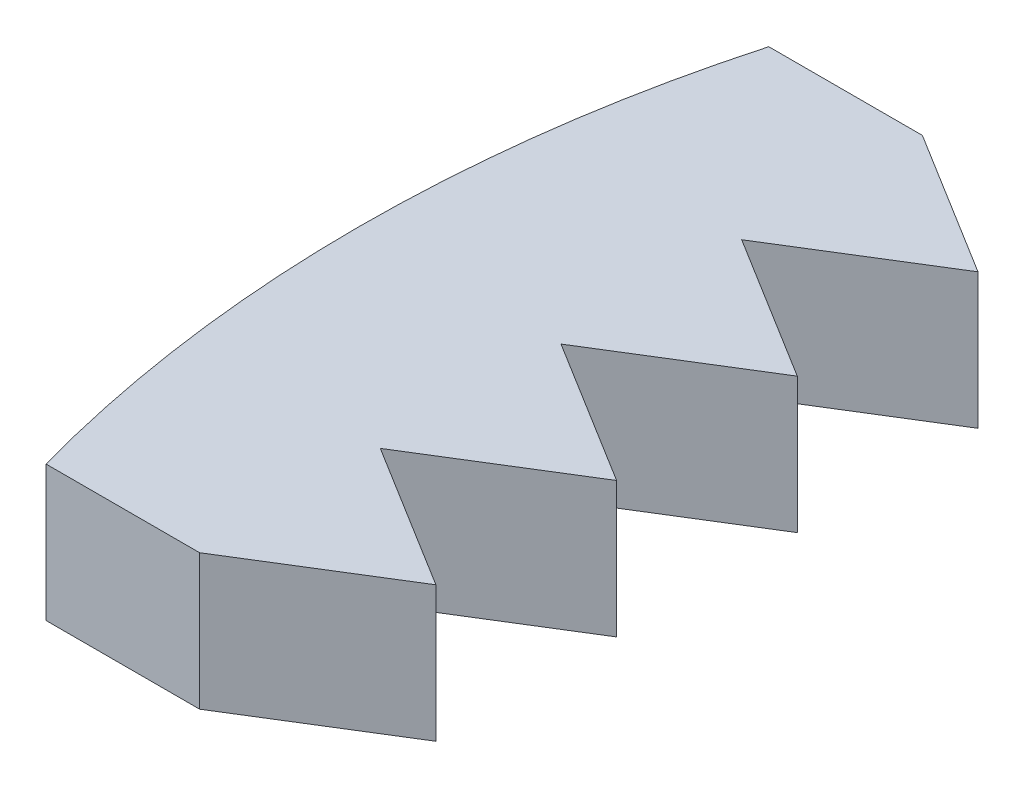
from build123d import *

# Parameters (mm, degrees)
BOSS_EXTRUDE1_DEPTH = 3.81


with BuildPart() as part:
    # Sketch1 → Boss-Extrude1 (new body)
    with BuildSketch(Plane(origin=(0, 0, 0), x_dir=(1, 0, 0), z_dir=(0, 1, 0))):
        with BuildLine():
            Line((-30.793742763, 27.560180372), (-26.69024718, 25.020180372))
            Line((-26.69024718, 25.020180372), (-30.793742763, 22.480180372))
            Line((-30.793742763, 22.480180372), (-26.69024718, 19.940180372))
            Line((-26.69024718, 19.940180372), (-30.793742763, 17.400180372))
            Line((-30.793742763, 17.400180372), (-26.69024718, 14.860180372))
            Line((-26.69024718, 14.860180372), (-30.793742763, 12.320180372))
            Line((-30.793742763, 12.320180372), (-26.69024718, 9.780180372))
            Line((-26.69024718, 9.780180372), (-30.793742763, 7.240180372))
            Line((-30.793742763, 7.240180372), (-35.111742763, 7.240180372))
            ThreePointArc((-35.111742763, 7.240180372), (-36.491388734, 17.400180372), (-35.111742763, 27.560180372))
            Line((-35.111742763, 27.560180372), (-30.793742763, 27.560180372))
        make_face()
    extrude(amount=BOSS_EXTRUDE1_DEPTH)


solid = part.part
